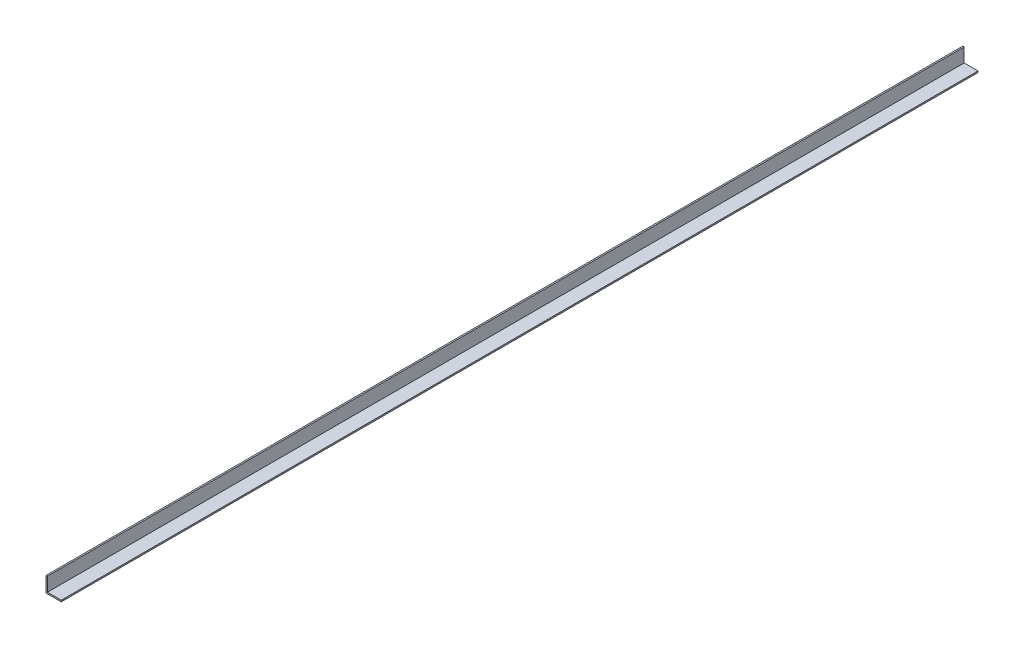
from build123d import *

# Parameters (mm, degrees)
SALIENTE_EXTRUIR1_DEPTH = 6100


with BuildPart() as part:
    # Croquis1 → Saliente-Extruir1 (new body)
    with BuildSketch(Plane.XY):
        Polygon((0, 101.6), (0, 0), (101.6, 0), (101.6, 9.53), (9.53, 9.53), (9.53, 101.6), align=None)
    extrude(amount=-SALIENTE_EXTRUIR1_DEPTH)


solid = part.part
